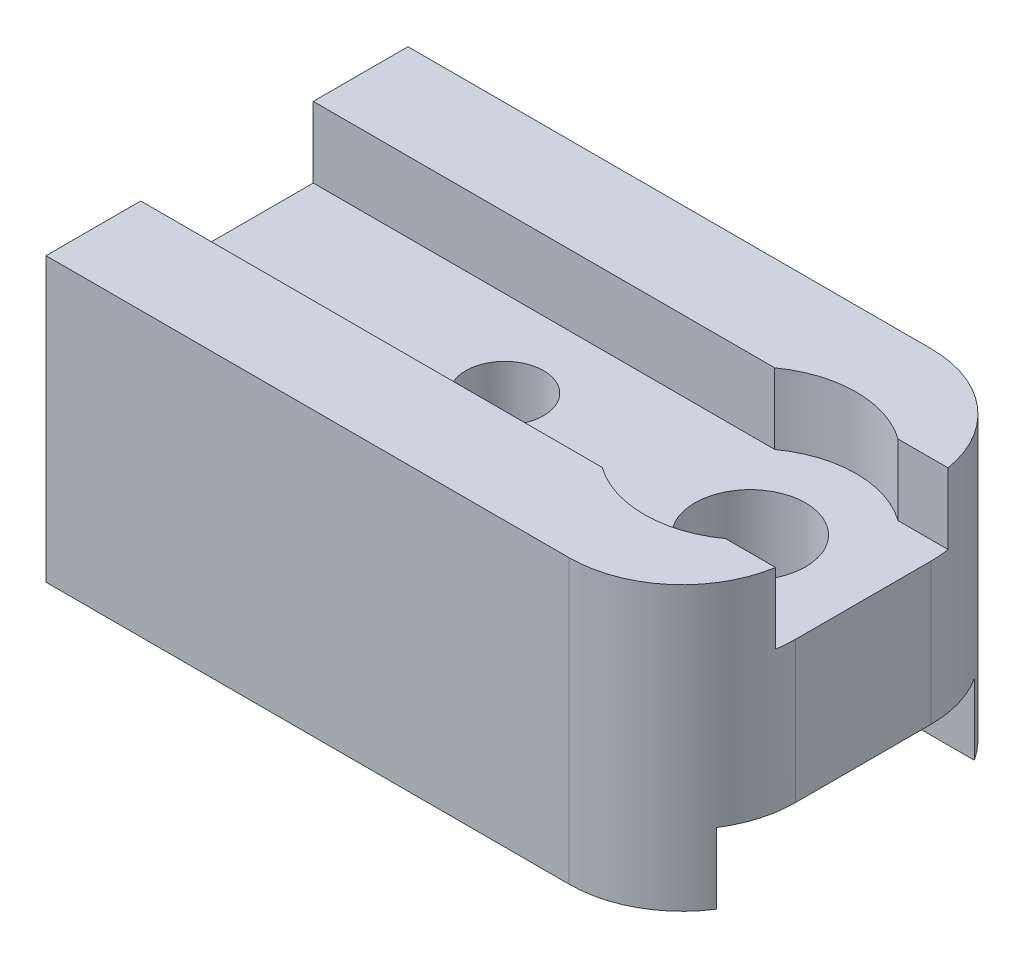
from build123d import *

# Parameters (mm, degrees)
SKETCH1_W           = 28.575
SKETCH1_H           = 16.256
SKETCH1_R           = 2.4892
SKETCH1_R_2         = 1.75
BOSS_EXTRUDE1_DEPTH = 12.7
SKETCH2_W           = 36.398054667
SKETCH2_H           = 7.747
CUT_EXTRUDE1_DEPTH  = 3.175
SKETCH3_W           = 33.032622038
SKETCH3_H           = 11.5824
CUT_EXTRUDE2_DEPTH  = 3.175
SKETCH4_R           = 3.7465
CUT_EXTRUDE3_DEPTH  = 3.6322
FILLET1_R           = 5.08
SKETCH5_R           = 4.7625
CUT_EXTRUDE4_DEPTH  = 35.227383569


with BuildPart() as part:
    # Sketch1 → Boss-Extrude1 (new body)
    with BuildSketch(Plane(origin=(0, 0, 0), x_dir=(1, 0, 0), z_dir=(0, 1, 0))):
        with Locations((14.2875, 8.128)):
            Rectangle(SKETCH1_W, SKETCH1_H)
        with Locations(Location((23.495, 8.128, 0), (0, 0, 270))):
            Circle(SKETCH1_R, mode=Mode.SUBTRACT)
        with Locations(Location((12.4714, 8.128, 0), (0, 0, 270))):
            Circle(SKETCH1_R_2, mode=Mode.SUBTRACT)
    extrude(amount=BOSS_EXTRUDE1_DEPTH)

    # Sketch2 → Cut-Extrude1 (cut)
    with BuildSketch(Plane(origin=(0, 12.7, 0), x_dir=(1, 0, 0), z_dir=(0, 1, 0))):
        with Locations((15.783080999, 8.128)):
            Rectangle(SKETCH2_W, SKETCH2_H)
    extrude(amount=-CUT_EXTRUDE1_DEPTH, mode=Mode.SUBTRACT)

    # Sketch3 → Cut-Extrude2 (cut)
    with BuildSketch(Plane.XZ):
        with Locations((15.449592918, -8.128)):
            Rectangle(SKETCH3_W, SKETCH3_H)
    extrude(amount=-CUT_EXTRUDE2_DEPTH, mode=Mode.SUBTRACT)

    # Sketch4 → Cut-Extrude3 (cut)
    with BuildSketch(Plane.XZ.offset(-3.175)):
        with Locations(Location((12.4714, -8.128, 0), (0, 0, 270))):
            Circle(SKETCH4_R)
    extrude(amount=-CUT_EXTRUDE3_DEPTH, mode=Mode.SUBTRACT)

    # Fillet1
    fillet1_edges = [part.edges().sort_by_distance(p)[0] for p in [
        (28.575, 6.35, -16.256),
        (28.575, 6.35, 0),
    ]]
    fillet(fillet1_edges, radius=FILLET1_R)

    # Sketch5 → Cut-Extrude4 (cut, through all)
    with BuildSketch(Plane(origin=(0, 9.525, 0), x_dir=(1, 0, 0), z_dir=(0, 1, 0))):
        with Locations((23.495, 8.128)):
            Circle(SKETCH5_R)
    extrude(amount=CUT_EXTRUDE4_DEPTH, mode=Mode.SUBTRACT)


solid = part.part
